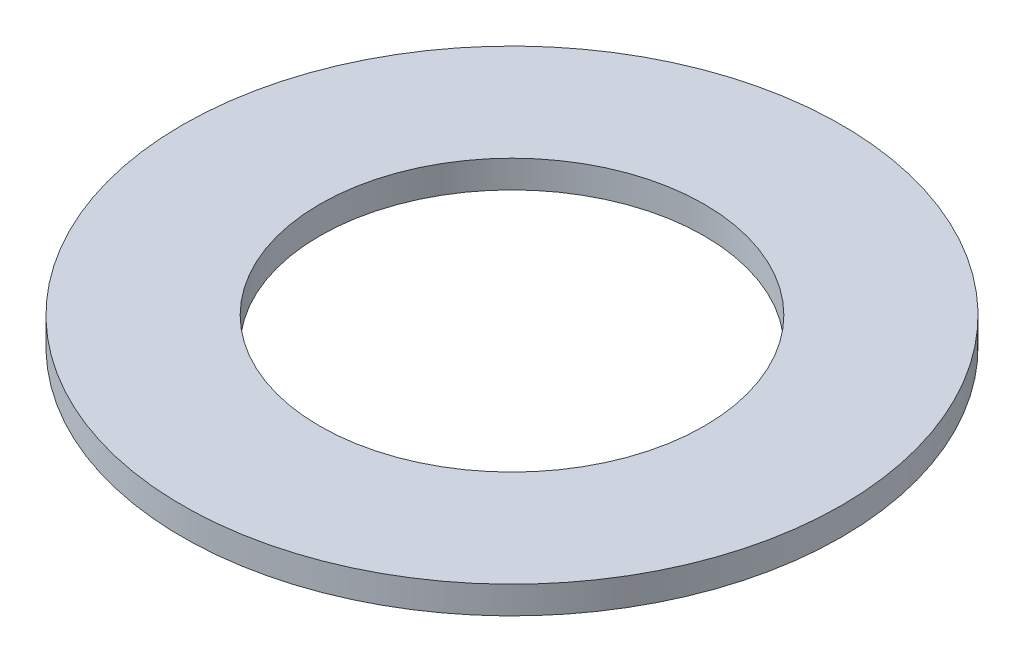
from build123d import *

# Parameters (mm, degrees)
SKETCH1_R           = 12
SKETCH1_R_2         = 7
EXTRUDE_THIN1_DEPTH = 1


with BuildPart() as part:
    # Sketch1 → Extrude-Thin1 (new body)
    with BuildSketch(Plane(origin=(0, 0, 0), x_dir=(1, 0, 0), z_dir=(0, 1, 0))):
        Circle(SKETCH1_R)
        Circle(SKETCH1_R_2, mode=Mode.SUBTRACT)
    extrude(amount=EXTRUDE_THIN1_DEPTH)


solid = part.part
